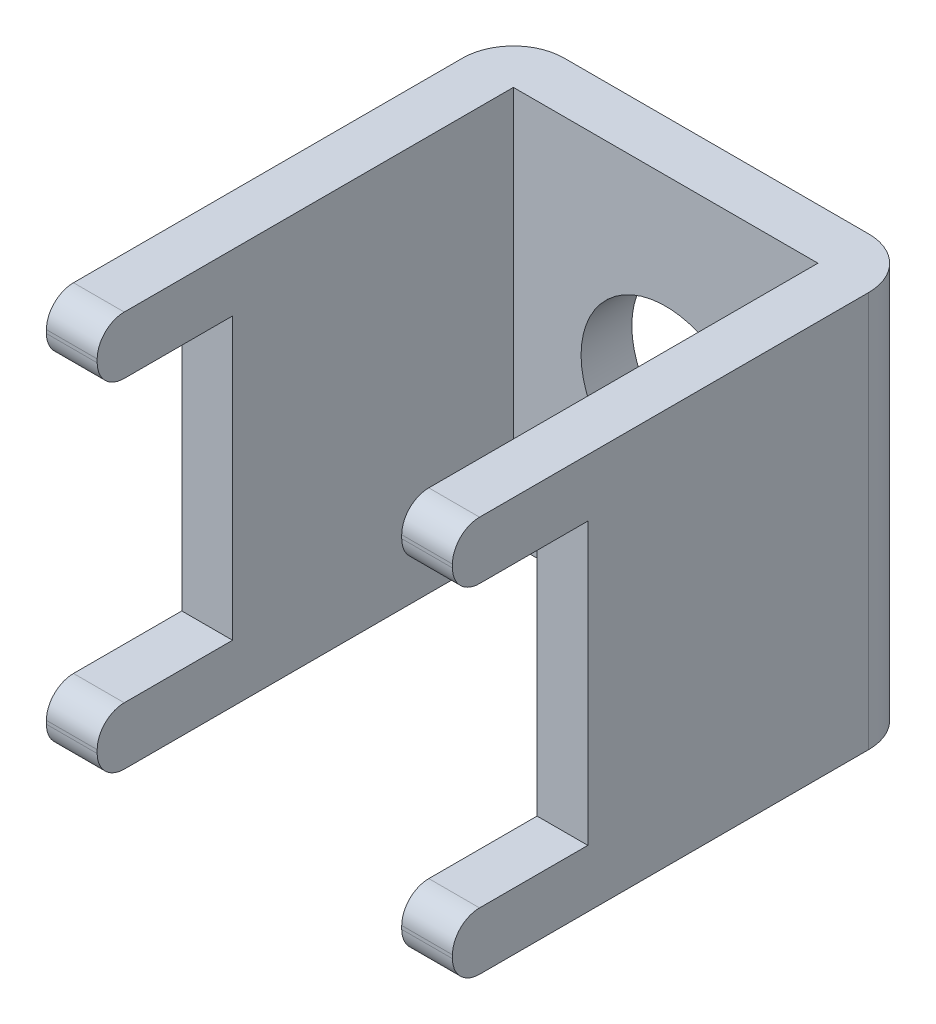
from build123d import *

# Parameters (mm, degrees)
BOSS_EXTRUDE1_DEPTH = 11.7
CUT_EXTRUDE2_REACH  = 23.71
SKETCH2_W           = 4
SKETCH2_H           = 8.3
FILLET1_R           = 0.8
SKETCH3_R           = 2.5
CUT_EXTRUDE3_DEPTH  = 1.5


with BuildPart() as part:
    # Sketch1 → Boss-Extrude1 (new body)
    with BuildSketch(Plane(origin=(0, 0, 0), x_dir=(1, 0, 0), z_dir=(0, 1, 0))):
        with BuildLine():
            Line((0, 0), (-1.5, 0))
            Line((-1.5, 0), (-1.5, 12.3))
            ThreePointArc((-1.5, 12.3), (-1.060660172, 13.360660172), (0, 13.8))
            Line((0, 13.8), (9, 13.8))
            ThreePointArc((9, 13.8), (10.060660172, 13.360660172), (10.5, 12.3))
            Line((10.5, 12.3), (10.5, 0))
            Line((10.5, 0), (9, 0))
            Line((9, 0), (9, 12.3))
            Line((9, 12.3), (0, 12.3))
            Line((0, 12.3), (0, 0))
        make_face()
    extrude(amount=BOSS_EXTRUDE1_DEPTH)

    # Cut-Extrude2: up to this face of the body (flat: up to its plane)
    cut_extrude2_end = Plane(part.part.faces().sort_by_distance((-1.5, 5.85, -6.15))[0])
    # Sketch2 → Cut-Extrude2 (cut, up to the picked face)
    with BuildSketch(Plane(origin=(10.5, 0, 0), x_dir=(0, 0, -1), z_dir=(1, 0, 0)), mode=Mode.PRIVATE) as cut_extrude2_sk1:
        with Locations((2, 5.85)):
            Rectangle(SKETCH2_W, SKETCH2_H)
    cut_extrude2_tool1 = split(extrude(cut_extrude2_sk1.sketch, amount=-CUT_EXTRUDE2_REACH, mode=Mode.PRIVATE), bisect_by=cut_extrude2_end, keep=Keep.BOTH, mode=Mode.PRIVATE)
    add(cut_extrude2_tool1.solids().sort_by(Axis((10.5, 5.85, -2), (-1, 0, 0)))[0], mode=Mode.SUBTRACT)

    # Fillet1
    fillet1_edges = [part.edges().sort_by_distance(p)[0] for p in [
        (-0.75, 0, 0),
        (9.75, 0, 0),
        (9.75, 11.7, 0),
        (-0.75, 1.7, 0),
        (9.75, 1.7, 0),
        (-0.75, 11.7, 0),
        (-0.75, 10, 0),
        (9.75, 10, 0),
    ]]
    fillet(fillet1_edges, radius=FILLET1_R)

    # Sketch3 → Cut-Extrude3 (cut)
    with BuildSketch(Plane(origin=(0, 0, -13.8), x_dir=(-1, 0, 0), z_dir=(0, 0, -1))):
        with Locations((-4.5, 5.85)):
            Circle(SKETCH3_R)
    extrude(amount=-CUT_EXTRUDE3_DEPTH, mode=Mode.SUBTRACT)


solid = part.part
